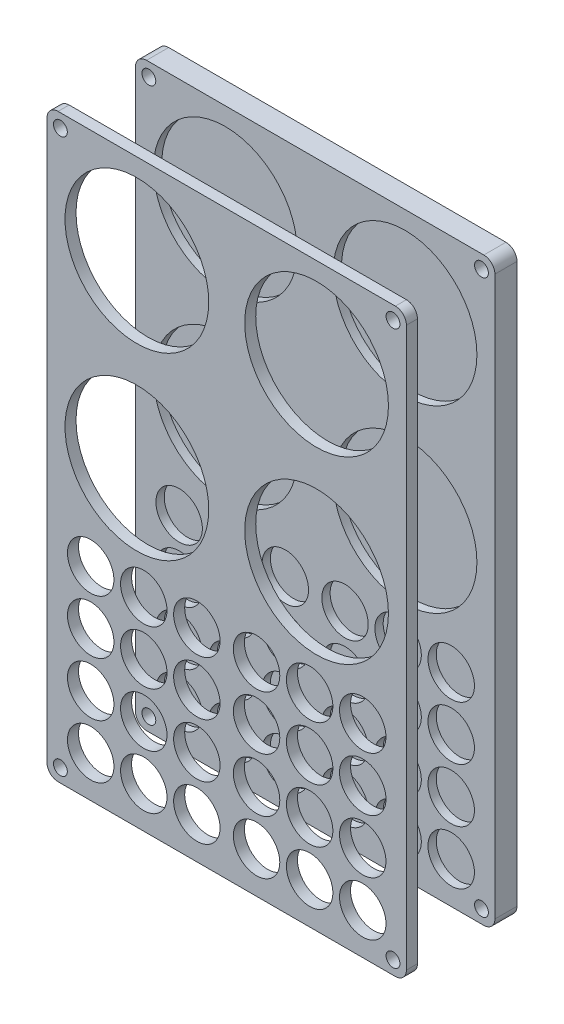
from build123d import *

# Parameters (mm, degrees)
SKETCH1_W                          = 210
SKETCH1_H                          = 130
F_120_X_200_X_67_TH_DEPTH          = 40
SKETCH2_R                          = 26
SKETCH2_R_2                        = 8.4
F_16_8_D_AND_52_D_TUBE_HOLES_DEPTH = 35
F_4_MM_R_FILET_R                   = 4
CUT_EXTRUDE1_DEPTH                 = 130.807549857
CUT_EXTRUDE1_DEPTH_BACK            = 130.807549857
SKETCH3_W                          = 210
SKETCH3_H                          = 28
CUT_EXTRUDE2_DEPTH                 = 130.807549857
CUT_EXTRUDE2_DEPTH_BACK            = 130.807549857
SKETCH2_3_R                        = 2.5


with BuildPart() as part:
    # Sketch1 → 120 x 200 x 67 th (new body)
    with BuildSketch(Plane(origin=(0, 0, 0), x_dir=(0, 1, 0), z_dir=(0, 0, 1))):
        Rectangle(SKETCH1_W, SKETCH1_H)
    extrude(amount=F_120_X_200_X_67_TH_DEPTH)

    # Sketch2 → 16.8 D and 52 D tube holes (cut)
    with BuildSketch(Plane.XY.offset(40)):
        with Locations((-32.5, 72.5)):
            Circle(SKETCH2_R)
        with Locations((10.8, -31.641617153)):
            Circle(SKETCH2_R_2)
        with Locations((30, -31.641617153)):
            Circle(SKETCH2_R_2)
        with Locations((49.2, -31.641617153)):
            Circle(SKETCH2_R_2)
        with Locations((-10.8, -31.641617153)):
            Circle(SKETCH2_R_2)
        with Locations((-30, -31.641617153)):
            Circle(SKETCH2_R_2)
        with Locations((-49.2, -31.641617153)):
            Circle(SKETCH2_R_2)
        with Locations((10.8, -51.141617153)):
            Circle(SKETCH2_R_2)
        with Locations((30, -51.141617153)):
            Circle(SKETCH2_R_2)
        with Locations((49.2, -51.141617153)):
            Circle(SKETCH2_R_2)
        with Locations((-10.8, -51.141617153)):
            Circle(SKETCH2_R_2)
        with Locations((-30, -51.141617153)):
            Circle(SKETCH2_R_2)
        with Locations((-49.2, -51.141617153)):
            Circle(SKETCH2_R_2)
        with Locations((10.8, -70.641617153)):
            Circle(SKETCH2_R_2)
        with Locations((30, -70.641617153)):
            Circle(SKETCH2_R_2)
        with Locations((49.2, -70.641617153)):
            Circle(SKETCH2_R_2)
        with Locations((-10.8, -70.641617153)):
            Circle(SKETCH2_R_2)
        with Locations((-30, -70.641617153)):
            Circle(SKETCH2_R_2)
        with Locations((-49.2, -70.641617153)):
            Circle(SKETCH2_R_2)
        with Locations((10.8, -90.141617153)):
            Circle(SKETCH2_R_2)
        with Locations((30, -90.141617153)):
            Circle(SKETCH2_R_2)
        with Locations((49.2, -90.141617153)):
            Circle(SKETCH2_R_2)
        with Locations((-10.8, -90.141617153)):
            Circle(SKETCH2_R_2)
        with Locations((-30, -90.141617153)):
            Circle(SKETCH2_R_2)
        with Locations((-49.2, -90.141617153)):
            Circle(SKETCH2_R_2)
        with Locations((32.5, 72.5)):
            Circle(SKETCH2_R)
        with Locations((32.5, 7.5)):
            Circle(SKETCH2_R)
        with Locations((-32.5, 7.5)):
            Circle(SKETCH2_R)
    extrude(amount=-F_16_8_D_AND_52_D_TUBE_HOLES_DEPTH, mode=Mode.SUBTRACT)

    # 4 mm R filet
    f_4_mm_r_filet_edges = [part.edges().sort_by_distance(p)[0] for p in [
        (-65, 105, 20),
        (65, 105, 20),
        (-65, -105, 20),
        (65, -105, 20),
    ]]
    fillet(f_4_mm_r_filet_edges, radius=F_4_MM_R_FILET_R)

    # Sketch3 → Cut-Extrude1 (cut, two sides: drawn at the far end of the back side and taken through both)
    with BuildSketch(Plane.YZ.offset(-CUT_EXTRUDE1_DEPTH_BACK)):
        with Locations((0, 22)):
            Rectangle(SKETCH3_W, SKETCH3_H)
    extrude(amount=CUT_EXTRUDE1_DEPTH + CUT_EXTRUDE1_DEPTH_BACK, mode=Mode.SUBTRACT)


with BuildPart() as cut_extrude1_piece_1:
    # of the separate pieces the step leaves, piece 1, a body of its own (cut_extrude1_pieces)
    add(part.part.solids().sort_by_distance((65, -101, 0))[0])


with BuildPart() as cut_extrude1_piece_2:
    # of the separate pieces the step leaves, piece 2, a body of its own (cut_extrude1_pieces)
    add(part.part.solids().sort_by_distance((65, 101, 36))[0])


with BuildPart() as cut_extrude2_tool:
    # Sketch2<3> → Cut-Extrude2 (new, two sides: drawn at the far end of the back side and taken through both)
    with BuildSketch(Plane.XY.offset(40).offset(-CUT_EXTRUDE2_DEPTH_BACK)):
        with Locations((-60.158155916, -100.158155916)):
            Circle(SKETCH2_3_R)
        with Locations((-60.158155916, 100.158155916)):
            Circle(SKETCH2_3_R)
        with Locations((60.158155916, -100.158155916)):
            Circle(SKETCH2_3_R)
        with Locations((60.158155916, 100.158155916)):
            Circle(SKETCH2_3_R)
    extrude(amount=CUT_EXTRUDE2_DEPTH + CUT_EXTRUDE2_DEPTH_BACK)


with BuildPart() as cut_extrude1_piece_1_1:
    add(cut_extrude1_piece_1.part)

    # Cut-Extrude2: cut by cut_extrude2_tool
    add(cut_extrude2_tool.part, mode=Mode.SUBTRACT)


with BuildPart() as cut_extrude1_piece_2_1:
    add(cut_extrude1_piece_2.part)

    # Cut-Extrude2: cut by cut_extrude2_tool
    add(cut_extrude2_tool.part, mode=Mode.SUBTRACT)


solid = Compound([cut_extrude1_piece_1_1.part, cut_extrude1_piece_2_1.part])
